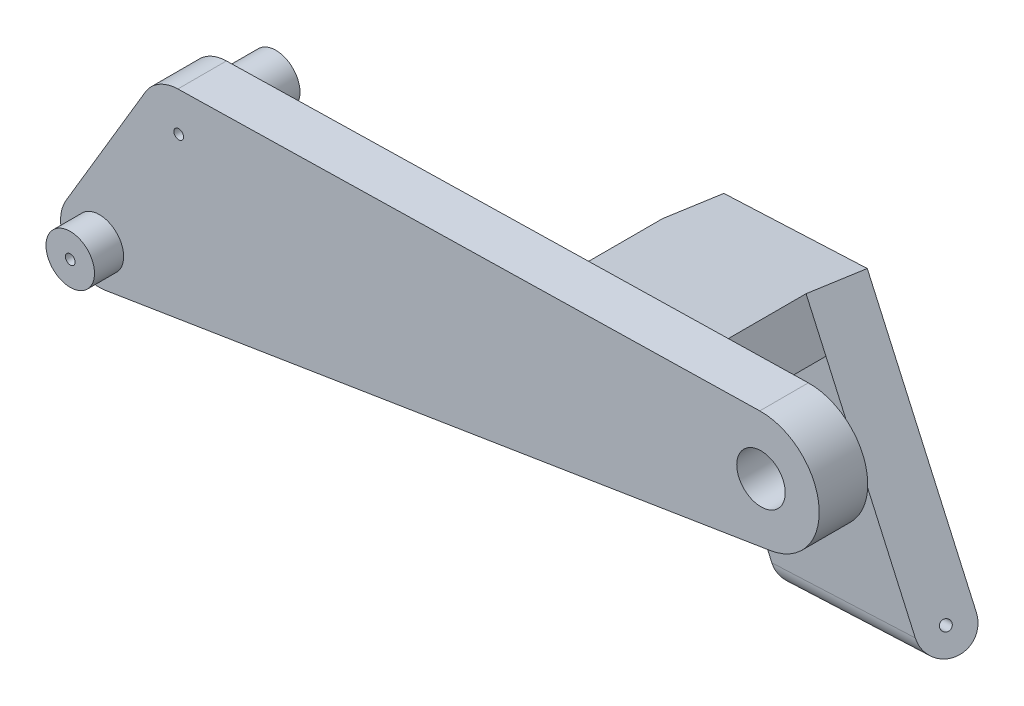
from build123d import *

# Parameters (mm, degrees)
SKETCH3_R            = 2.5
BOSS_EXTRUDE1_DEPTH  = 5
BOSS_EXTRUDE2_START  = -10
SKETCH4_R            = 2.5
SKETCH4_R_2          = 0.5
BOSS_EXTRUDE2_DEPTH  = 10
SKETCH5_R            = 2.5
SKETCH5_R_2          = 0.5
BOSS_EXTRUDE3_DEPTH  = 8
SKETCH6_R            = 2.5
CUT_EXTRUDE1_DEPTH   = 5
BOSS_EXTRUDE4_DEPTH  = 20
CUT_EXTRUDE13_DEPTH  = 5
BOSS_EXTRUDE10_DEPTH = 5
SKETCH30_R           = 0.5
CUT_EXTRUDE14_DEPTH  = 30
FILLET5_RADIUS       = 2.5
FILLET5_LENGTH       = 30


with BuildPart() as part:
    # Sketch3 → Boss-Extrude1 (new body)
    with BuildSketch(Plane.XY):
        with BuildLine():
            Line((-11.610773808, -11.712810576), (-3.438942124, 2.042957921))
            ThreePointArc((-3.438942124, 2.042957921), (-2.014609444, 3.455625673), (-0.083557945, 3.999127163))
            Line((-0.083557945, 3.999127163), (59.874663083, 5.251896962))
            ThreePointArc((59.874663083, 5.251896962), (65.975546591, -0.205644141), (60.95435529, -6.67040805))
            Line((60.95435529, -6.67040805), (-7.535594823, -17.704844674))
            ThreePointArc((-7.535594823, -17.704844674), (-11.479384761, -16.005233464), (-11.610773808, -11.712810576))
        make_face()
        with Locations((-8.171831684, -13.755768497)):
            Circle(SKETCH3_R, mode=Mode.SUBTRACT)
        Circle(SKETCH3_R, mode=Mode.SUBTRACT)
    extrude(amount=BOSS_EXTRUDE1_DEPTH)

    # Sketch4 → Boss-Extrude2 (add)
    with BuildSketch(Plane.XY.offset(5).offset(BOSS_EXTRUDE2_START)):
        Circle(SKETCH4_R)
        Circle(SKETCH4_R_2, mode=Mode.SUBTRACT)
    extrude(amount=BOSS_EXTRUDE2_DEPTH)

    # Sketch5 → Boss-Extrude3 (add)
    with BuildSketch(Plane(origin=(0, 0, 0), x_dir=(-1, 0, 0), z_dir=(0, 0, -1))):
        with Locations((8.171831684, -13.755768497)):
            Circle(SKETCH5_R)
        with Locations((8.171831684, -13.755768497)):
            Circle(SKETCH5_R_2, mode=Mode.SUBTRACT)
    extrude(amount=-BOSS_EXTRUDE3_DEPTH)

    # Sketch6 → Cut-Extrude1 (cut)
    with BuildSketch(Plane(origin=(0, 0, 0), x_dir=(-1, 0, 0), z_dir=(0, 0, -1))):
        with Locations((-60, -0.746793783)):
            Circle(SKETCH6_R)
    extrude(amount=-CUT_EXTRUDE1_DEPTH, mode=Mode.SUBTRACT)

    # Sketch7 → Boss-Extrude4 (add)
    with BuildSketch(Plane(origin=(0, 0, 0), x_dir=(-1, 0, 0), z_dir=(0, 0, -1))):
        Polygon((-26.911463264, -12.155068704), (-52.460374438, -0.698492522), (-50.414557263, 3.863813045), (-24.865646089, -7.592763137), align=None)
    extrude(amount=BOSS_EXTRUDE4_DEPTH)

    # Sketch28 → Cut-Extrude13 (cut)
    with BuildSketch(Plane(origin=(6.997600739, -15.605105477, 0), x_dir=(0.9124611133732353, 0.40916343504970737, 0), z_dir=(-0.40916343504970737, 0.9124611133732353, 0))):
        Polygon((19.582254068, 20), (47.582254068, 20), (47.582254068, 9.229670386), align=None)
    extrude(amount=-CUT_EXTRUDE13_DEPTH, mode=Mode.SUBTRACT)

    # Sketch29 → Boss-Extrude10 (add)
    with BuildSketch(Plane(origin=(8.417885726, 3.774726384, -23.983783628), x_dir=(-0.944773131235322, 0.04085915546839103, -0.3251680487228334), z_dir=(0.3275835650410869, 0.14689416871972955, -0.9333333333333338))):
        Polygon((-17.29926723, -10.786775434), (-44.471253078, 1.928694872), (-57.186723384, -25.243290975), (-30.014737537, -37.958761281), align=None)
    extrude(amount=BOSS_EXTRUDE10_DEPTH)

    # Sketch30 → Cut-Extrude14 (cut)
    with BuildSketch(Plane(origin=(9.450159624, 4.237615956, 3.983783628), x_dir=(-0.34024655631398143, -0.11822381508735179, 0.9328748096409659), z_dir=(-0.8516303724816865, -0.38188587271306007, -0.3590109871422995))):
        with Locations(Location((-29.580972966, -43.696559912, 0), (0, 0, 268.203952105))):
            Circle(SKETCH30_R)
    extrude(amount=-CUT_EXTRUDE14_DEPTH, mode=Mode.SUBTRACT)

    # Fillet5: full round fillet: the end face becomes a half cylinder, R = half its width
    fillet5_face = Plane((50.73396364, -28.871073026, -16.948168526), x_dir=(-0.851630372482, -0.381885872713, -0.359010987142), z_dir=(0.40916343505, -0.912461113373, 0))  # on the end face: x along it, z out of the body
    fillet5_slab = fillet5_face.offset(-FILLET5_RADIUS / 2) * Box(FILLET5_LENGTH, 2 * FILLET5_RADIUS, FILLET5_RADIUS, mode=Mode.PRIVATE)  # the body's end, R deep
    fillet5_round = Plane((49.711055052, -26.589920243, -16.948168526), x_dir=(0.40916343505, -0.912461113373, 0), z_dir=(-0.851630372482, -0.381885872713, -0.359010987142)) * Cylinder(FILLET5_RADIUS, FILLET5_LENGTH, mode=Mode.PRIVATE)  # its axis R under the face
    add(fillet5_slab - fillet5_round, mode=Mode.SUBTRACT)


solid = part.part
